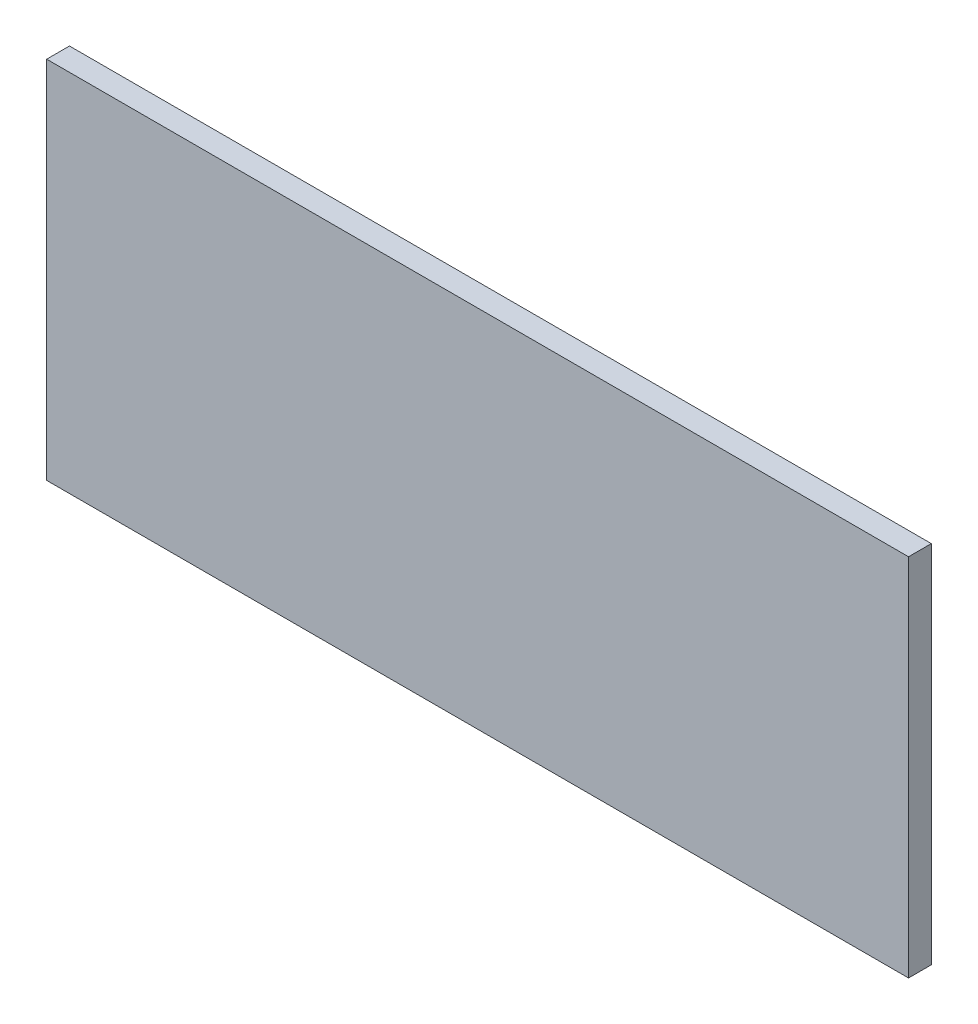
from build123d import *

# Parameters (mm, degrees)
SKETCH1_W           = 189
SKETCH1_H           = 80
BOSS_EXTRUDE1_DEPTH = 5


with BuildPart() as part:
    # Sketch1 → Boss-Extrude1 (new body)
    with BuildSketch(Plane.XY):
        Rectangle(SKETCH1_W, SKETCH1_H)
    extrude(amount=BOSS_EXTRUDE1_DEPTH)


solid = part.part
